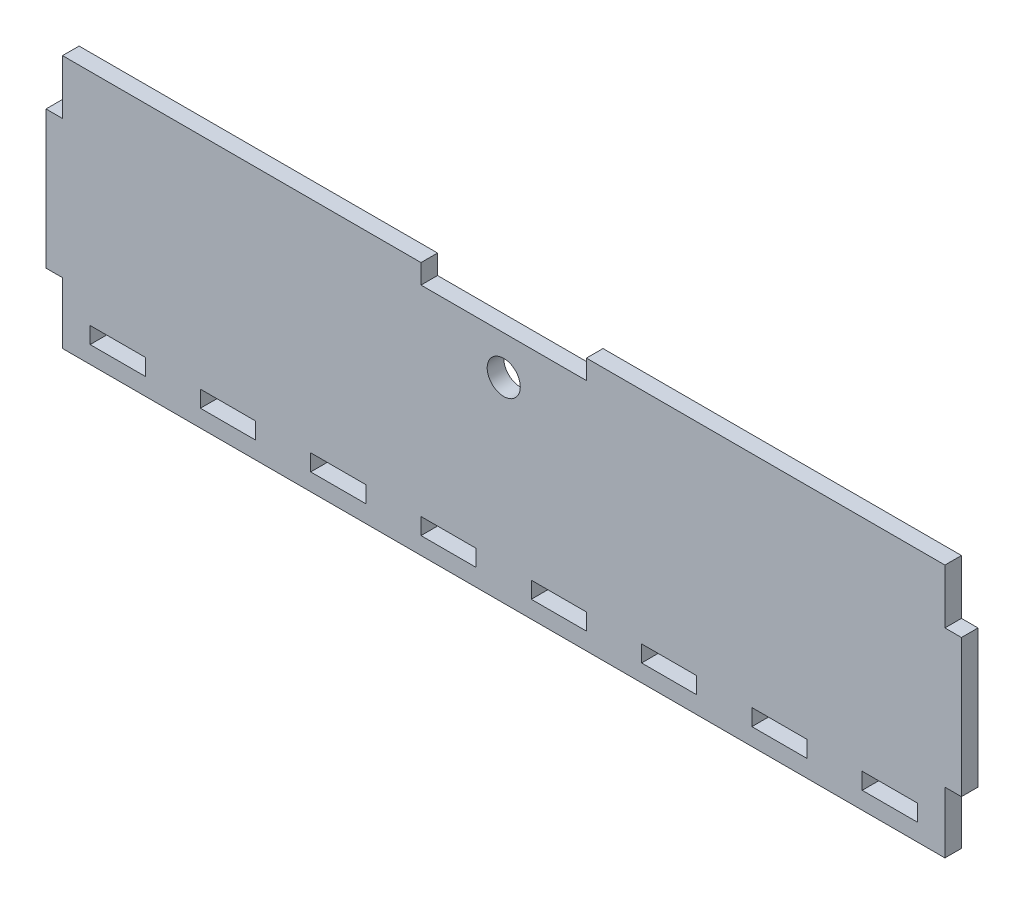
from build123d import *

# Parameters (mm, degrees)
SKETCH1_R           = 3
SKETCH1_W           = 10
SKETCH1_H           = 3
BOSS_EXTRUDE1_DEPTH = 3


with BuildPart() as part:
    # Sketch1 → Boss-Extrude1 (new body)
    with BuildSketch(Plane.XY):
        Polygon((-31.361502347, 21.305164319), (33.638497653, 21.305164319), (33.638497653, 17.769219388), (63.638497653, 17.769219388), (63.638497653, 21.305164319), (128.638497653, 21.305164319), (128.638497653, 11.427031749), (131.638497653, 11.427031749), (131.638497653, -13.572968251), (128.638497653, -13.572968251), (128.638497653, -24.694835681), (-31.361502347, -24.694835681), (-31.361502347, -13.572968251), (-34.361502347, -13.572968251), (-34.361502347, 11.427031749), (-31.361502347, 11.427031749), align=None)
        with Locations((48.638497653, 10.769219388)):
            Circle(SKETCH1_R, mode=Mode.SUBTRACT)
        with Locations((-1.361502347, -20.072968251)):
            Rectangle(SKETCH1_W, SKETCH1_H, mode=Mode.SUBTRACT)
        with Locations((-21.361502347, -20.072968251)):
            Rectangle(SKETCH1_W, SKETCH1_H, mode=Mode.SUBTRACT)
        with Locations((18.638497653, -20.072968251)):
            Rectangle(SKETCH1_W, SKETCH1_H, mode=Mode.SUBTRACT)
        with Locations((38.638497653, -20.072968251)):
            Rectangle(SKETCH1_W, SKETCH1_H, mode=Mode.SUBTRACT)
        with Locations((58.638497653, -20.072968251)):
            Rectangle(SKETCH1_W, SKETCH1_H, mode=Mode.SUBTRACT)
        with Locations((78.638497653, -20.072968251)):
            Rectangle(SKETCH1_W, SKETCH1_H, mode=Mode.SUBTRACT)
        with Locations((98.638497653, -20.072968251)):
            Rectangle(SKETCH1_W, SKETCH1_H, mode=Mode.SUBTRACT)
        with Locations((118.638497653, -20.072968251)):
            Rectangle(SKETCH1_W, SKETCH1_H, mode=Mode.SUBTRACT)
    extrude(amount=BOSS_EXTRUDE1_DEPTH)


solid = part.part
